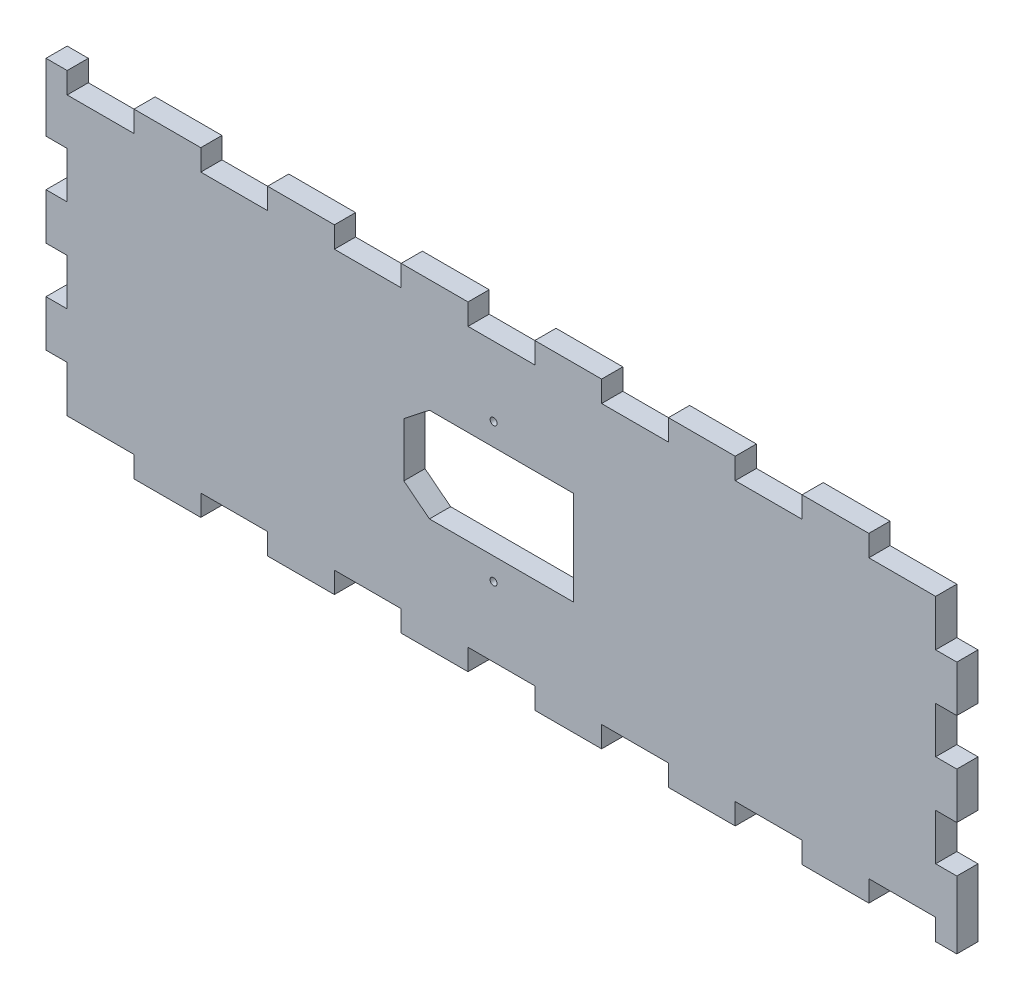
from build123d import *

# Parameters (mm, degrees)
SKETCH1_W           = 19.230769231
SKETCH1_H           = 6.096
SKETCH1_W_2         = 6.096
SKETCH1_H_2         = 13.333333333
SKETCH1_H_3         = 13.333333334
BOSS_EXTRUDE1_DEPTH = 6.096
SKETCH2_R           = 1
CUT_EXTRUDE1_DEPTH  = 271.249595093


with BuildPart() as part:
    # Sketch1 → Boss-Extrude1 (new body)
    with BuildSketch(Plane.XY):
        Polygon((76.923076923, 80), (57.692307692, 80), (38.461538462, 80), (19.230769231, 80), (0, 80), (0, 66.666666667), (0, 53.333333333), (0, 40), (0, 26.666666667), (0, 13.333333333), (0, 0), (19.230769231, 0), (38.461538462, 0), (57.692307692, 0), (76.923076923, 0), (96.153846154, 0), (115.384615385, 0), (134.615384615, 0), (153.846153846, 0), (173.076923077, 0), (192.307692308, 0), (211.538461538, 0), (230.769230769, 0), (250, 0), (250, 13.333333333), (250, 26.666666667), (250, 40), (250, 53.333333333), (250, 66.666666667), (250, 80), (230.769230769, 80), (211.538461538, 80), (192.307692308, 80), (173.076923077, 80), (153.846153846, 80), (134.615384615, 80), (115.384615385, 80), (96.153846154, 80), align=None)
        with Locations((28.846153847, 83.048)):
            Rectangle(SKETCH1_W, SKETCH1_H)
        with Locations((-3.048, 73.333333334)):
            Rectangle(SKETCH1_W_2, SKETCH1_H_2)
        with Locations((-3.048, 83.048)):
            Rectangle(SKETCH1_W_2, SKETCH1_H)
        with Locations((-3.048, 46.666666667)):
            Rectangle(SKETCH1_W_2, SKETCH1_H_2)
        with Locations((-3.048, 20)):
            Rectangle(SKETCH1_W_2, SKETCH1_H_3)
        with Locations((28.846153847, -3.048)):
            Rectangle(SKETCH1_W, SKETCH1_H)
        with Locations((67.307692308, -3.048)):
            Rectangle(SKETCH1_W, SKETCH1_H)
        with Locations((105.76923077, -3.048)):
            Rectangle(SKETCH1_W, SKETCH1_H)
        with Locations((144.230769231, -3.048)):
            Rectangle(SKETCH1_W, SKETCH1_H)
        with Locations((182.692307693, -3.048)):
            Rectangle(SKETCH1_W, SKETCH1_H)
        with Locations((221.153846154, -3.048)):
            Rectangle(SKETCH1_W, SKETCH1_H)
        with Locations((253.048, 6.666666667)):
            Rectangle(SKETCH1_W_2, SKETCH1_H_2)
        with Locations((253.048, -3.048)):
            Rectangle(SKETCH1_W_2, SKETCH1_H)
        with Locations((253.048, 33.333333334)):
            Rectangle(SKETCH1_W_2, SKETCH1_H_2)
        with Locations((253.048, 60)):
            Rectangle(SKETCH1_W_2, SKETCH1_H_3)
        with Locations((221.153846154, 83.048)):
            Rectangle(SKETCH1_W, SKETCH1_H)
        with Locations((182.692307693, 83.048)):
            Rectangle(SKETCH1_W, SKETCH1_H)
        with Locations((144.230769231, 83.048)):
            Rectangle(SKETCH1_W, SKETCH1_H)
        with Locations((105.76923077, 83.048)):
            Rectangle(SKETCH1_W, SKETCH1_H)
        with Locations((67.307692308, 83.048)):
            Rectangle(SKETCH1_W, SKETCH1_H)
    extrude(amount=BOSS_EXTRUDE1_DEPTH)

    # Sketch2 → Cut-Extrude1 (cut, through all)
    with BuildSketch(Plane.XY.offset(6.096)):
        with Locations((122.750419351, 59.96058)):
            Circle(SKETCH2_R)
        with Locations((122.750419351, 20.03942)):
            Circle(SKETCH2_R)
        Polygon((145.720049351, 53.5509), (104.279950649, 53.5509), (96.910579351, 47.7597), (96.910579351, 32.2403), (104.279950649, 26.4491), (145.720049351, 26.4491), align=None)
    extrude(amount=-CUT_EXTRUDE1_DEPTH, mode=Mode.SUBTRACT)


solid = part.part
